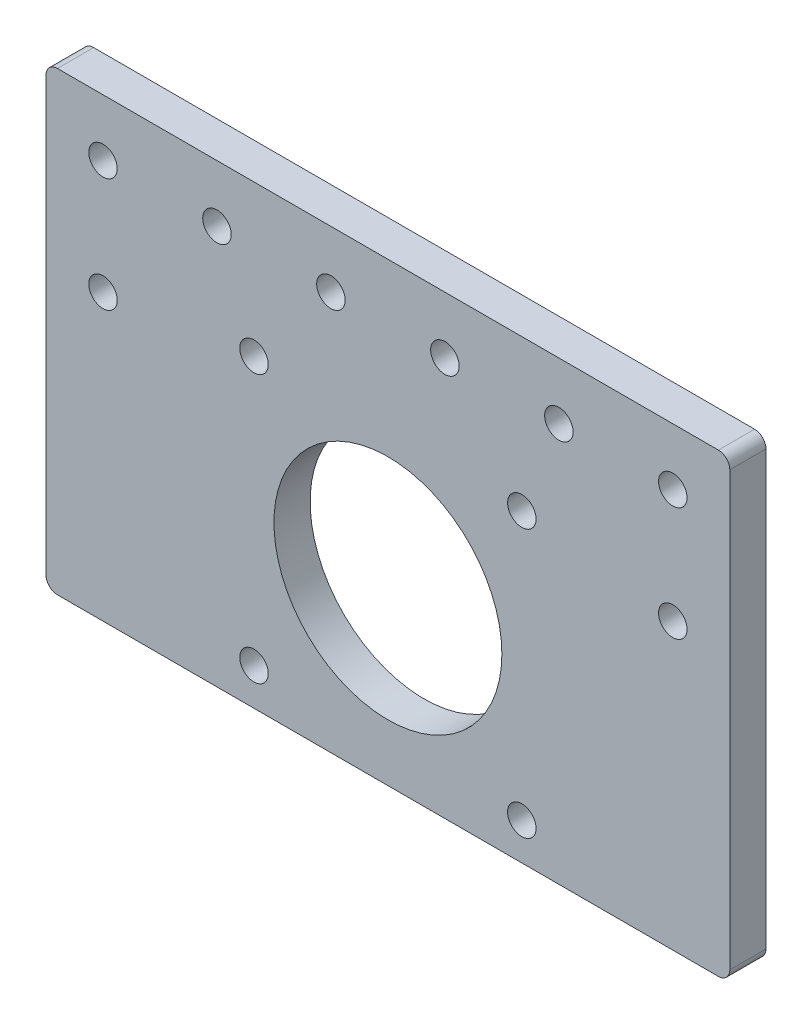
from build123d import *

# Parameters (mm, degrees)
SKETCH1_W           = 120
SKETCH1_H           = 80
SKETCH1_R           = 2.5
SKETCH1_R_2         = 20
BOSS_EXTRUDE1_DEPTH = 6.35
FILLET1_R           = 2


with BuildPart() as part:
    # Sketch1 → Boss-Extrude1 (new body)
    with BuildSketch(Plane.XY):
        Rectangle(SKETCH1_W, SKETCH1_H)
        with Locations((-50, 30)):
            Circle(SKETCH1_R, mode=Mode.SUBTRACT)
        with Locations((-30, 30)):
            Circle(SKETCH1_R, mode=Mode.SUBTRACT)
        with Locations((-10, 30)):
            Circle(SKETCH1_R, mode=Mode.SUBTRACT)
        with Locations((10, 30)):
            Circle(SKETCH1_R, mode=Mode.SUBTRACT)
        with Locations((30, 30)):
            Circle(SKETCH1_R, mode=Mode.SUBTRACT)
        with Locations((50, 30)):
            Circle(SKETCH1_R, mode=Mode.SUBTRACT)
        with Locations((-50, 10)):
            Circle(SKETCH1_R, mode=Mode.SUBTRACT)
        with Locations((50, 10)):
            Circle(SKETCH1_R, mode=Mode.SUBTRACT)
        with Locations((0, -10)):
            Circle(SKETCH1_R_2, mode=Mode.SUBTRACT)
        with Locations((-23.5, 13.5)):
            Circle(SKETCH1_R, mode=Mode.SUBTRACT)
        with Locations((23.5, 13.5)):
            Circle(SKETCH1_R, mode=Mode.SUBTRACT)
        with Locations((23.5, -33.5)):
            Circle(SKETCH1_R, mode=Mode.SUBTRACT)
        with Locations((-23.5, -33.5)):
            Circle(SKETCH1_R, mode=Mode.SUBTRACT)
    extrude(amount=BOSS_EXTRUDE1_DEPTH)

    # Fillet1
    fillet1_edges = [part.edges().sort_by_distance(p)[0] for p in [
        (60, -40, 3.175),
        (-60, -40, 3.175),
        (-60, 40, 3.175),
        (60, 40, 3.175),
    ]]
    fillet(fillet1_edges, radius=FILLET1_R)


solid = part.part
